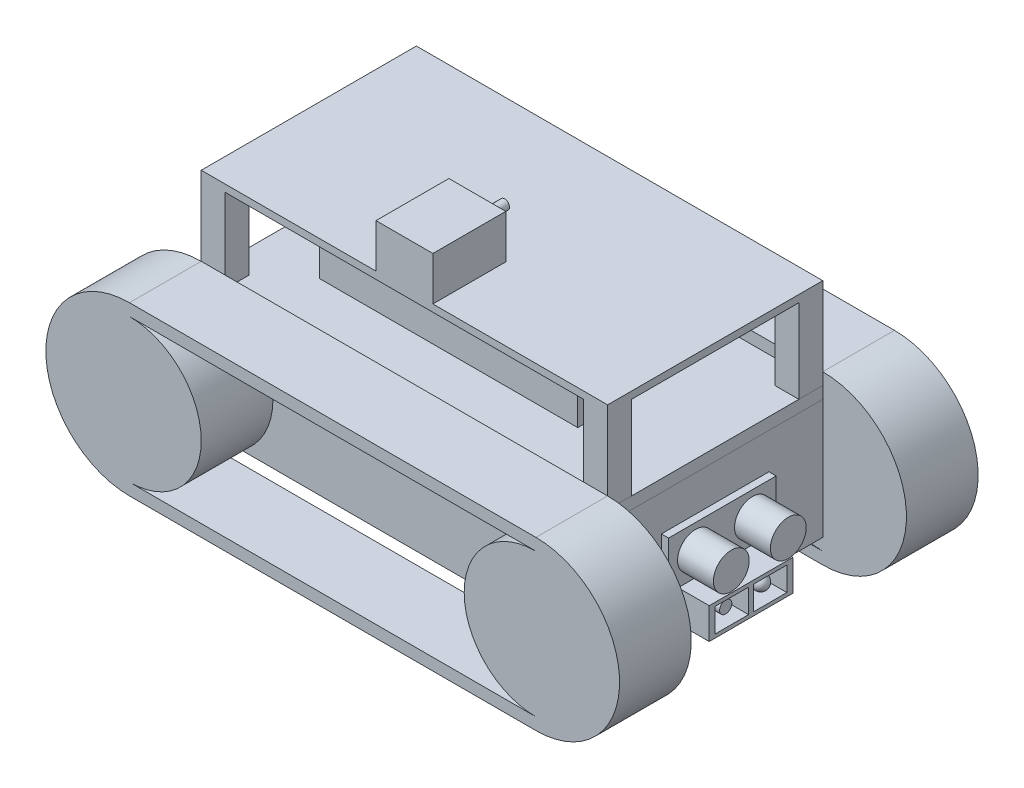
from build123d import *

# Parameters (mm, degrees)
SKETCH1_W            = 170
SKETCH1_H            = 90
BOSS_EXTRUDE1_DEPTH  = 50
SKETCH2_R            = 30
BOSS_EXTRUDE2_DEPTH  = 30
LPATTERN1_COUNT      = 2
LPATTERN1_PITCH      = 120
BOSS_EXTRUDE3_START  = -30
BOSS_EXTRUDE3_DEPTH  = 30
LPATTERN2_COUNT      = 2
LPATTERN2_PITCH      = 120
SKETCH4_W            = 170
SKETCH4_H            = 90
BOSS_EXTRUDE6_DEPTH  = 5
SKETCH6_W            = 108
SKETCH6_H            = 53
BOSS_EXTRUDE7_DEPTH  = 15
SKETCH7_W            = 170
SKETCH7_H            = 90
BOSS_EXTRUDE8_DEPTH  = 3
SKETCH8_W            = 23.8
SKETCH8_H            = 18.3
BOSS_EXTRUDE9_DEPTH  = 30.5
SKETCH9_R            = 2.00605959
BOSS_EXTRUDE10_DEPTH = 11.45
SKETCH10_W           = 45
SKETCH10_H           = 20
BOSS_EXTRUDE11_DEPTH = 3
SKETCH11_R           = 7.5
BOSS_EXTRUDE12_DEPTH = 15
SKETCH12_W           = 35
SKETCH12_H           = 13
SKETCH12_W_2         = 14
SKETCH12_H_2         = 10
BOSS_EXTRUDE13_DEPTH = 15
SKETCH13_R           = 2.55
BOSS_EXTRUDE14_DEPTH = 2.4
SKETCH14_R           = 3
BOSS_EXTRUDE15_DEPTH = 8.6
FILLET1_R            = 3
SKETCH15_W           = 35
SKETCH15_H           = 15
BOSS_EXTRUDE16_DEPTH = 13
SKETCH17_W           = 10
SKETCH17_H           = 30
CUT_EXTRUDE1_DEPTH   = 12
SKETCH18_W           = 10
SKETCH18_H           = 2
BOSS_EXTRUDE17_DEPTH = 12
SKETCH20_W           = 10
SKETCH20_H           = 10
BOSS_EXTRUDE20_DEPTH = 35
SKETCH21_R           = 2.55
BOSS_EXTRUDE21_DEPTH = 2.4
SKETCH24_R           = 3
BOSS_EXTRUDE22_DEPTH = 6
FILLET2_R            = 3


with BuildPart() as part:
    # Sketch1 → Boss-Extrude1 (new body)
    with BuildSketch(Plane(origin=(0, 0, 0), x_dir=(1, 0, 0), z_dir=(0, 1, 0))):
        with Locations((85, 45)):
            Rectangle(SKETCH1_W, SKETCH1_H)
    extrude(amount=BOSS_EXTRUDE1_DEPTH)

    # Sketch2 → Boss-Extrude2 (add)
    with BuildSketch(Plane.XY):
        with Locations(Location((170, 25, 0), (0, 0, 236.442690238))):
            Circle(SKETCH2_R)
        with Locations(Location((0, 25, 0), (0, 0, 303.557309762))):
            Circle(SKETCH2_R)
    boss_extrude2 = extrude(amount=BOSS_EXTRUDE2_DEPTH)

    # LPattern1: Boss-Extrude2 ×2
    with Locations(*[(0, 0, -i * LPATTERN1_PITCH) for i in range(1, LPATTERN1_COUNT)]):
        add(boss_extrude2)

    # Sketch3 → Boss-Extrude3 (add)
    with BuildSketch(Plane.XY.offset(30).offset(BOSS_EXTRUDE3_START)):
        with BuildLine():
            Line((0, 60), (170, 60))
            ThreePointArc((170, 60), (205, 25), (170, -10))
            Line((170, -10), (0, -10))
            ThreePointArc((0, -10), (-35, 25), (0, 60))
        make_face()
        with BuildLine():
            Line((170, 55), (0, 55))
            ThreePointArc((0, 55), (-30, 25), (0, -5))
            Line((0, -5), (170, -5))
            ThreePointArc((170, -5), (200, 25), (170, 55))
        make_face(mode=Mode.SUBTRACT)
    boss_extrude3 = extrude(amount=BOSS_EXTRUDE3_DEPTH)

    # LPattern2: Boss-Extrude3 ×2
    with Locations(*[(0, 0, -i * LPATTERN2_PITCH) for i in range(1, LPATTERN2_COUNT)]):
        add(boss_extrude3)

    # Sketch10 → Boss-Extrude11 (add)
    with BuildSketch(Plane(origin=(170, 0, 0), x_dir=(0, 0, -1), z_dir=(1, 0, 0))):
        with Locations((45, 25)):
            Rectangle(SKETCH10_W, SKETCH10_H)
    extrude(amount=BOSS_EXTRUDE11_DEPTH)

    # Sketch11 → Boss-Extrude12 (add)
    with BuildSketch(Plane(origin=(173, 0, 0), x_dir=(0, 0, -1), z_dir=(1, 0, 0))):
        with Locations((57.588236396, 25)):
            Circle(SKETCH11_R)
        with Locations((33.75, 25)):
            Circle(SKETCH11_R)
    extrude(amount=BOSS_EXTRUDE12_DEPTH)

    # Sketch12 → Boss-Extrude13 (add)
    with BuildSketch(Plane(origin=(170, 0, 0), x_dir=(0, 0, -1), z_dir=(1, 0, 0))):
        with Locations((45, 7.5)):
            Rectangle(SKETCH12_W, SKETCH12_H)
        with Locations((37, 7.5)):
            Rectangle(SKETCH12_W_2, SKETCH12_H_2, mode=Mode.SUBTRACT)
        with Locations((53, 7.5)):
            Rectangle(SKETCH12_W_2, SKETCH12_H_2, mode=Mode.SUBTRACT)
    extrude(amount=BOSS_EXTRUDE13_DEPTH)

    # Sketch15 → Boss-Extrude16 (add)
    with BuildSketch(Plane.ZY):
        with Locations((-45, 7.5)):
            Rectangle(SKETCH15_W, SKETCH15_H)
    extrude(amount=BOSS_EXTRUDE16_DEPTH)

    # Sketch17 → Cut-Extrude1 (cut)
    with BuildSketch(Plane.XZ):
        with Locations((-6.5, -45)):
            Rectangle(SKETCH17_W, SKETCH17_H)
    extrude(amount=-CUT_EXTRUDE1_DEPTH, mode=Mode.SUBTRACT)

    # Sketch18 → Boss-Extrude17 (add)
    with BuildSketch(Plane.XZ.offset(-12)):
        with Locations((-6.5, -44.41753742)):
            Rectangle(SKETCH18_W, SKETCH18_H)
    extrude(amount=BOSS_EXTRUDE17_DEPTH)


with BuildPart() as body_2:
    # Sketch4 → Boss-Extrude6 (new body)
    with BuildSketch(Plane(origin=(0, 50, 0), x_dir=(1, 0, 0), z_dir=(0, 1, 0))):
        with Locations((85, 45)):
            Rectangle(SKETCH4_W, SKETCH4_H)
    extrude(amount=BOSS_EXTRUDE6_DEPTH)


with BuildPart() as body_3:
    # Sketch6 → Boss-Extrude7 (new body)
    with BuildSketch(Plane(origin=(0, 60, 0), x_dir=(1, 0, 0), z_dir=(0, 1, 0))):
        with Locations((85, 45)):
            Rectangle(SKETCH6_W, SKETCH6_H)
    extrude(amount=BOSS_EXTRUDE7_DEPTH)


with BuildPart() as body_4:
    # Sketch7 → Boss-Extrude8 (new body)
    with BuildSketch(Plane(origin=(0, 90, 0), x_dir=(1, 0, 0), z_dir=(0, 1, 0))):
        with Locations((85, 45)):
            Rectangle(SKETCH7_W, SKETCH7_H)
    extrude(amount=BOSS_EXTRUDE8_DEPTH)

    # Sketch8 → Boss-Extrude9 (add)
    with BuildSketch(Plane.XY):
        with Locations((85, 102.15)):
            Rectangle(SKETCH8_W, SKETCH8_H)
    extrude(amount=-BOSS_EXTRUDE9_DEPTH)

    # Sketch9 → Boss-Extrude10 (add)
    with BuildSketch(Plane(origin=(0, 0, -30.5), x_dir=(-1, 0, 0), z_dir=(0, 0, -1))):
        with Locations(Location((-85, 102.15, 0), (0, 0, 180))):
            Circle(SKETCH9_R)
    extrude(amount=BOSS_EXTRUDE10_DEPTH)

    # Sketch20 → Boss-Extrude20 (add)
    with BuildSketch(Plane.XZ.offset(-90)):
        with Locations((5, -5)):
            Rectangle(SKETCH20_W, SKETCH20_H)
        with Locations((165, -5)):
            Rectangle(SKETCH20_W, SKETCH20_H)
        with Locations((165, -85)):
            Rectangle(SKETCH20_W, SKETCH20_H)
        with Locations((5, -85)):
            Rectangle(SKETCH20_W, SKETCH20_H)
    extrude(amount=BOSS_EXTRUDE20_DEPTH)


with BuildPart() as body_5:
    # Sketch13 → Boss-Extrude14 (new body)
    with BuildSketch(Plane(origin=(180, 0, 0), x_dir=(0, 0, -1), z_dir=(1, 0, 0))):
        with Locations((37, 7.5)):
            Circle(SKETCH13_R)
    extrude(amount=BOSS_EXTRUDE14_DEPTH)


with BuildPart() as body_6:
    # Sketch14 → Boss-Extrude15 (new body)
    with BuildSketch(Plane(origin=(175.4, 0, 0), x_dir=(0, 0, -1), z_dir=(1, 0, 0))):
        with Locations(Location((53, 7.864274774, 0), (0, 0, 180))):
            Circle(SKETCH14_R)
    extrude(amount=BOSS_EXTRUDE15_DEPTH)

    # Fillet1
    fillet1_edges = [body_6.edges().sort_by_distance(p)[0] for p in [
        (184, 7.864274774, -56),
    ]]
    fillet(fillet1_edges, radius=FILLET1_R)


with BuildPart() as body_7:
    # Sketch21 → Boss-Extrude21 (new body)
    with BuildSketch(Plane(origin=(0, 0, 0), x_dir=(-1, 0, 0), z_dir=(0, -1, 0))):
        with Locations(Location((6.5, 52.458149235, 0), (0, 0, 90))):
            Circle(SKETCH21_R)
    extrude(amount=-BOSS_EXTRUDE21_DEPTH)


with BuildPart() as body_8:
    # Sketch24 → Boss-Extrude22 (new body)
    with BuildSketch(Plane(origin=(0, 0, 0), x_dir=(-1, 0, 0), z_dir=(0, -1, 0))):
        with Locations(Location((6.5, 36.70876871, 0), (0, 0, 90))):
            Circle(SKETCH24_R)
    extrude(amount=-BOSS_EXTRUDE22_DEPTH)

    # Fillet2
    fillet2_edges = [body_8.edges().sort_by_distance(p)[0] for p in [
        (-6.5, 0, -33.70876871),
    ]]
    fillet(fillet2_edges, radius=FILLET2_R)


solid = Compound([part.part, body_2.part, body_3.part, body_4.part, body_5.part, body_6.part, body_7.part, body_8.part])
